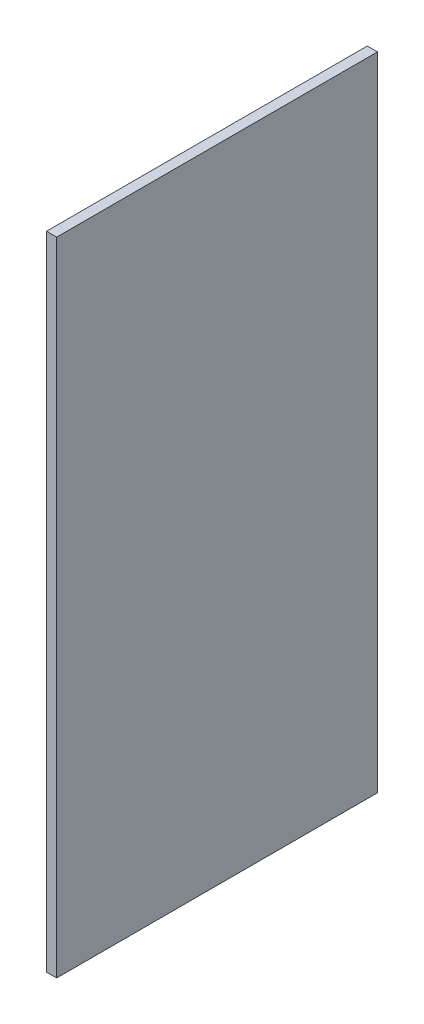
from build123d import *

# Parameters (mm, degrees)
SKETCH1_W           = 100
SKETCH1_H           = 200
BOSS_EXTRUDE1_DEPTH = 3.175


with BuildPart() as part:
    # Sketch1 → Boss-Extrude1 (new body)
    with BuildSketch(Plane(origin=(0, 0, 0), x_dir=(0, 0, -1), z_dir=(1, 0, 0))):
        with Locations((50, -100)):
            Rectangle(SKETCH1_W, SKETCH1_H)
    extrude(amount=BOSS_EXTRUDE1_DEPTH)


solid = part.part
